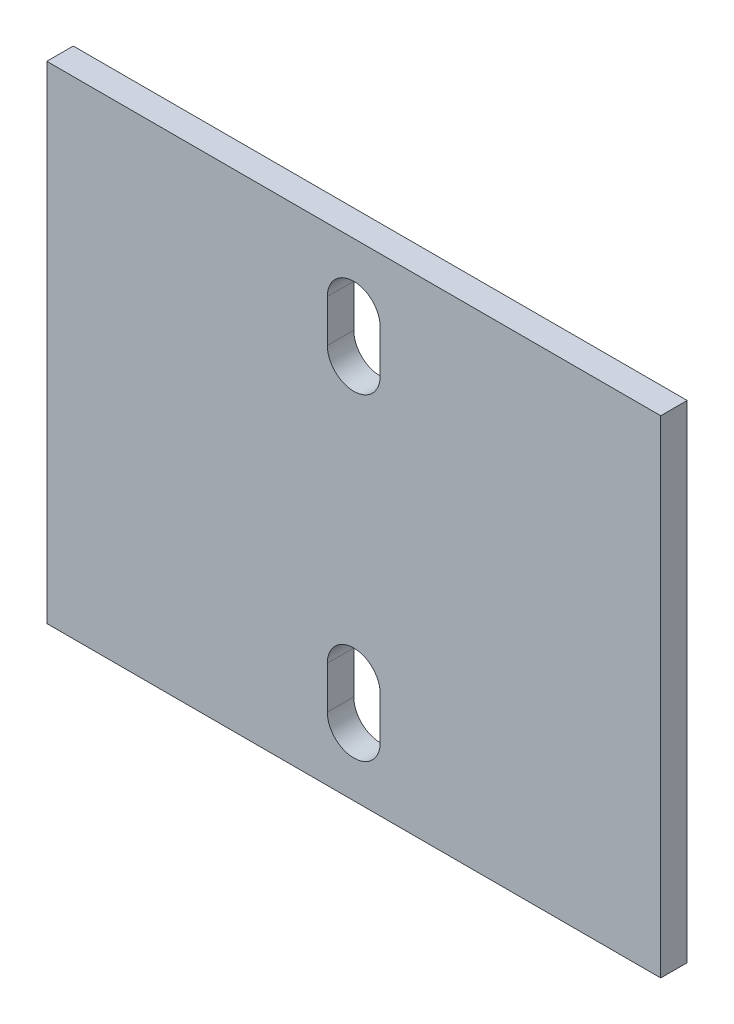
from build123d import *

# Parameters (mm, degrees)
SKETCH1_W           = 29
SKETCH1_H           = 23
BOSS_EXTRUDE1_DEPTH = 1.25


with BuildPart() as part:
    # Sketch1 → Boss-Extrude1 (new body)
    with BuildSketch(Plane.XY):
        Rectangle(SKETCH1_W, SKETCH1_H)
        with BuildLine():
            Line((-1.25, 6.5), (-1.25, 8.5))
            ThreePointArc((-1.25, 8.5), (0, 9.75), (1.25, 8.5))
            Line((1.25, 8.5), (1.25, 6.5))
            ThreePointArc((1.25, 6.5), (0, 5.25), (-1.25, 6.5))
        make_face(mode=Mode.SUBTRACT)
        with BuildLine():
            Line((1.25, -6.5), (1.25, -8.5))
            ThreePointArc((1.25, -8.5), (0, -9.75), (-1.25, -8.5))
            Line((-1.25, -8.5), (-1.25, -6.5))
            ThreePointArc((-1.25, -6.5), (0, -5.25), (1.25, -6.5))
        make_face(mode=Mode.SUBTRACT)
    extrude(amount=BOSS_EXTRUDE1_DEPTH)


solid = part.part
